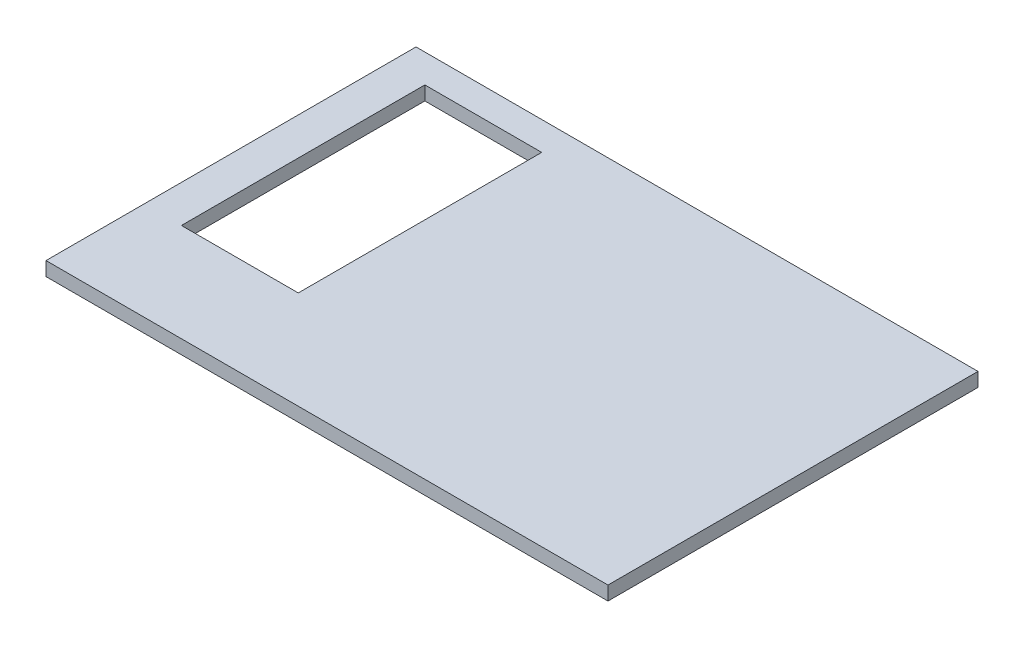
from build123d import *

# Parameters (mm, degrees)
SKETCH1_W           = 202
SKETCH1_H           = 133
SKETCH1_W_2         = 42.000003825
SKETCH1_H_2         = 87.499998164
BOSS_EXTRUDE2_DEPTH = 5


with BuildPart() as part:
    # Sketch1 → Boss-Extrude2 (new body)
    with BuildSketch(Plane(origin=(0, 0, 0), x_dir=(1, 0, 0), z_dir=(0, 1, 0))):
        with Locations((101, 66.5)):
            Rectangle(SKETCH1_W, SKETCH1_H)
        with Locations((34.417080689, 79.009996247)):
            Rectangle(SKETCH1_W_2, SKETCH1_H_2, mode=Mode.SUBTRACT)
    extrude(amount=BOSS_EXTRUDE2_DEPTH)


solid = part.part
